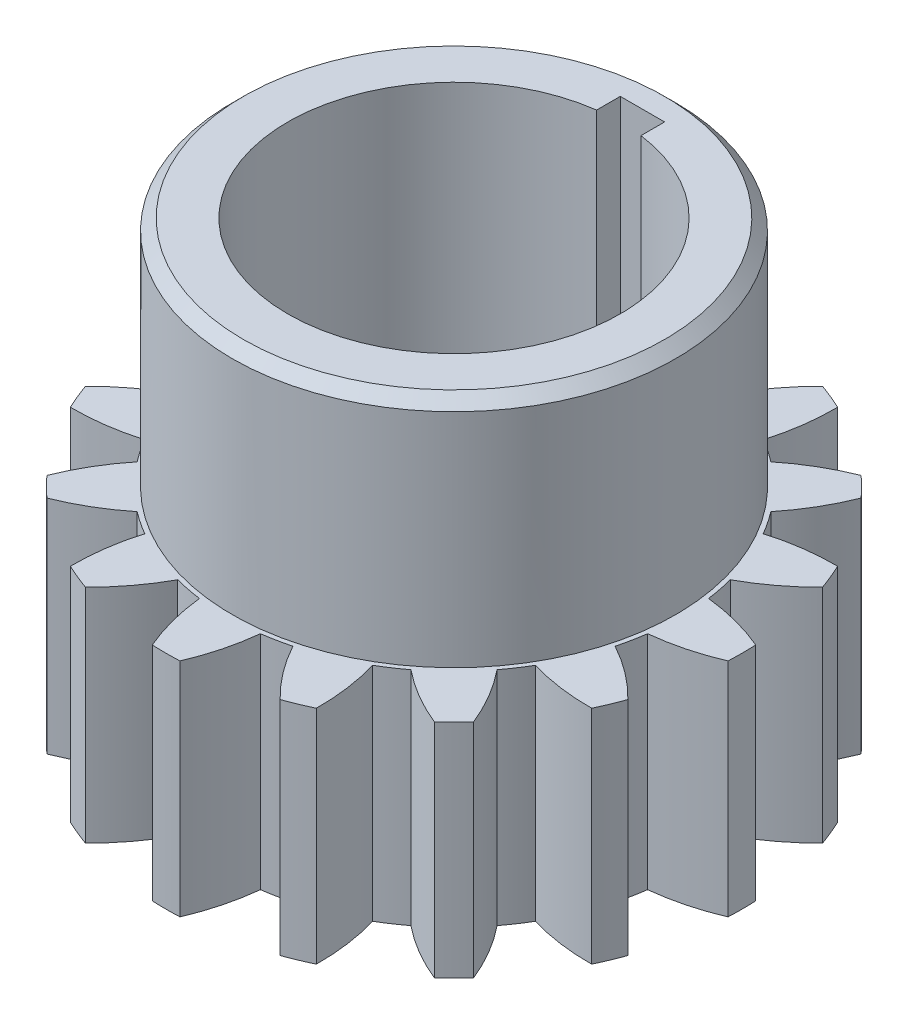
from build123d import *

# Parameters (mm, degrees)
SKETCH2_W           = 5
SKETCH2_H           = 21
SKETCH2_W_2         = 5.4
SKETCH2_H_2         = 20
BOSS_EXTRUDE1_DEPTH = 20
CIRPATTERN1_COUNT   = 16
SKETCH6_W           = 4
SKETCH6_H           = 4
CUT_EXTRUDE1_DEPTH  = 56.072679252
CHAMFER1_SIZE       = 1


with BuildPart() as part:
    # Sketch2 → Revolve1 (revolve)
    with BuildSketch(Plane.XY, mode=Mode.PRIVATE) as revolve1_sk:
        with Locations((17.5, 30.5)):
            Rectangle(SKETCH2_W, SKETCH2_H)
        with Locations((17.7, 10)):
            Rectangle(SKETCH2_W_2, SKETCH2_H_2)
    revolve(revolve1_sk.sketch.rotate(Axis((0, 0, 0), (0, 1, 0)), 90), axis=Axis((0, 0, 0), (0, 1, 0)))

    # Sketch4 → Boss-Extrude1 (add)
    with BuildSketch(Plane(origin=(0, 20, 0), x_dir=(1, 0, 0), z_dir=(0, 1, 0))):
        with BuildLine():
            ThreePointArc((-2.75, 20.213794795), (-1.37814843, 20.353395464), (0, 20.4))
            Line((0, 20.4), (0, 26))
            ThreePointArc((0, 26), (-0.62518076, 25.992482548), (-1.25, 25.96993454))
            ThreePointArc((-1.25, 25.96993454), (-2.215194302, 23.147942432), (-2.75, 20.213794795))
        make_face()
        with BuildLine():
            Line((0, 26), (0, 20.4))
            ThreePointArc((0, 20.4), (1.37814843, 20.353395464), (2.75, 20.213794795))
            ThreePointArc((2.75, 20.213794795), (2.215194302, 23.147942432), (1.25, 25.96993454))
            ThreePointArc((1.25, 25.96993454), (0.62518076, 25.992482548), (0, 26))
        make_face()
    boss_extrude1 = extrude(amount=-BOSS_EXTRUDE1_DEPTH)

    # CirPattern1: Boss-Extrude1 ×16 about axis
    cirpattern1_axis = Axis((0, 0, 0), (0, 1, 0))
    for i in range(1, CIRPATTERN1_COUNT):
        add(boss_extrude1.rotate(cirpattern1_axis, i * 360 / CIRPATTERN1_COUNT))

    # Sketch6 → Cut-Extrude1 (cut, through all)
    with BuildSketch(Plane(origin=(0, 41, 0), x_dir=(1, 0, 0), z_dir=(0, 1, 0))):
        with Locations((0, 15)):
            Rectangle(SKETCH6_W, SKETCH6_H)
    extrude(amount=-CUT_EXTRUDE1_DEPTH, mode=Mode.SUBTRACT)

    # Chamfer1
    chamfer1_edges = [part.edges().sort_by_distance(p)[0] for p in [
        (0, 41, 20),
    ]]
    chamfer(chamfer1_edges, length=CHAMFER1_SIZE)


solid = part.part
